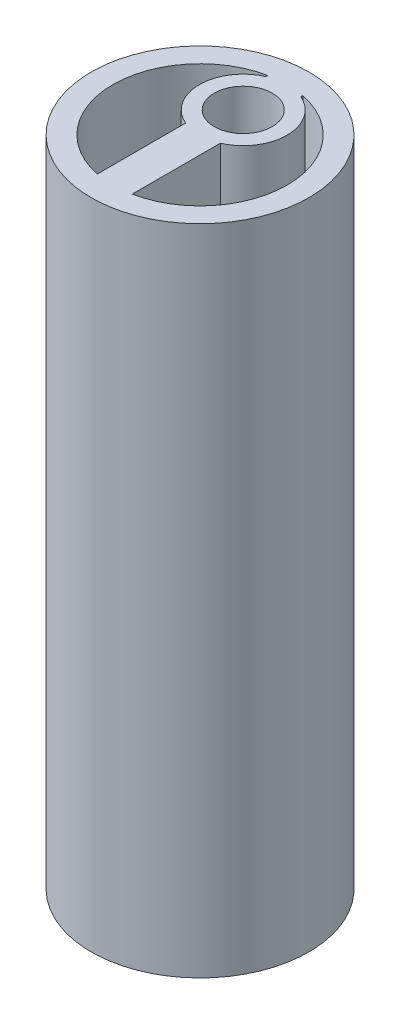
from build123d import *

# Parameters (mm, degrees)
SKETCH1_R           = 7.5
SKETCH1_R_2         = 6
BOSS_EXTRUDE1_DEPTH = 45
SKETCH3_W           = 2.4
SKETCH3_H           = 13.68952649
BOSS_EXTRUDE3_DEPTH = 45
SKETCH4_R           = 3.019619096
BOSS_EXTRUDE4_DEPTH = 45
SKETCH5_R           = 2
CUT_EXTRUDE1_DEPTH  = 47.233105022


with BuildPart() as part:
    # Sketch1 → Boss-Extrude1 (new body)
    with BuildSketch(Plane(origin=(0, 0, 0), x_dir=(1, 0, 0), z_dir=(0, 1, 0))):
        with Locations(Location((0, 0, 0), (0, 0, 90))):
            Circle(SKETCH1_R)
        with Locations(Location((0, 0, 0), (0, 0, 90))):
            Circle(SKETCH1_R_2, mode=Mode.SUBTRACT)
    extrude(amount=BOSS_EXTRUDE1_DEPTH)

    # Sketch3 → Boss-Extrude3 (add, through all)
    with BuildSketch(Plane(origin=(0, 45, 0), x_dir=(1, 0, 0), z_dir=(0, 1, 0))):
        with Locations((0, -0.095302319)):
            Rectangle(SKETCH3_W, SKETCH3_H)
    extrude(amount=-BOSS_EXTRUDE3_DEPTH)

    # Sketch4 → Boss-Extrude4 (add, through all)
    with BuildSketch(Plane(origin=(0, 45, 0), x_dir=(1, 0, 0), z_dir=(0, 1, 0))):
        with Locations((0, 2.974923027)):
            Circle(SKETCH4_R)
    extrude(amount=-BOSS_EXTRUDE4_DEPTH)

    # Sketch5 → Cut-Extrude1 (cut, through all)
    with BuildSketch(Plane(origin=(0, 45, 0), x_dir=(1, 0, 0), z_dir=(0, 1, 0))):
        with Locations(Location((0, 2.974923027, 0), (0, 0, 270))):
            Circle(SKETCH5_R)
    extrude(amount=-CUT_EXTRUDE1_DEPTH, mode=Mode.SUBTRACT)


solid = part.part
